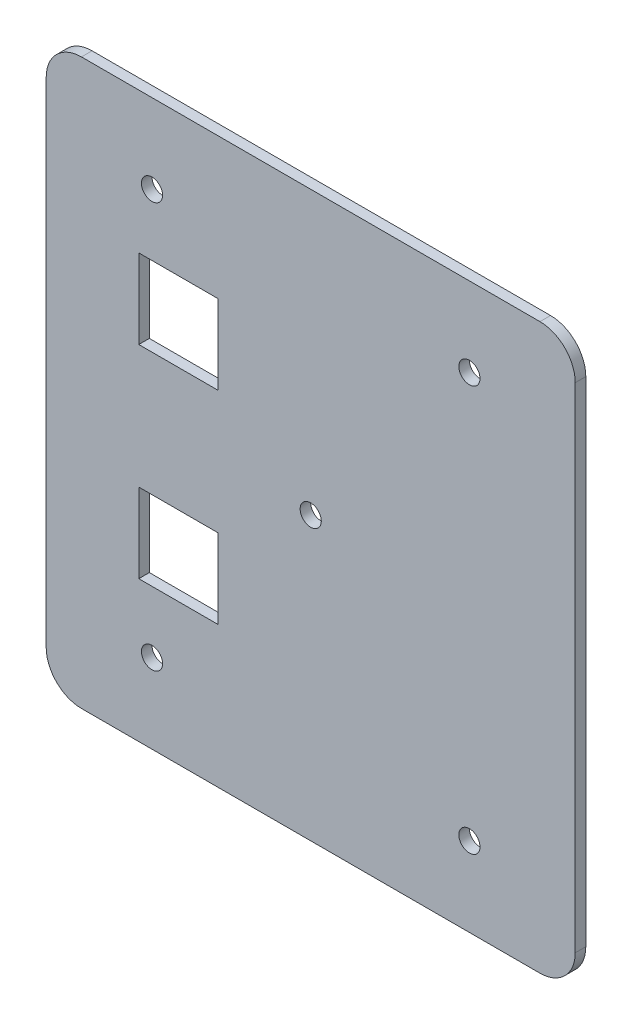
from build123d import *

# Parameters (mm, degrees)
SKETCH1_R           = 6
SKETCH1_W           = 45
SKETCH1_H           = 45
BOSS_EXTRUDE1_DEPTH = 6


with BuildPart() as part:
    # Sketch1 → Boss-Extrude1 (new body)
    with BuildSketch(Plane.XY):
        with BuildLine():
            Line((-55, -102.5), (205, -102.5))
            ThreePointArc((205, -102.5), (219.142135624, -96.642135624), (225, -82.5))
            Line((225, -82.5), (225, 197.5))
            ThreePointArc((225, 197.5), (219.142135624, 211.642135624), (205, 217.5))
            Line((205, 217.5), (-55, 217.5))
            ThreePointArc((-55, 217.5), (-69.142135624, 211.642135624), (-75, 197.5))
            Line((-75, 197.5), (-75, -82.5))
            ThreePointArc((-75, -82.5), (-69.142135624, -96.642135624), (-55, -102.5))
        make_face()
        with Locations((165, 172.5)):
            Circle(SKETCH1_R, mode=Mode.SUBTRACT)
        with Locations((-15, -57.5)):
            Circle(SKETCH1_R, mode=Mode.SUBTRACT)
        Polygon((22.5, -22.5), (-22.5, -22.5), (-22.5, 22.5), (0, 22.5), (22.5, 22.5), align=None, mode=Mode.SUBTRACT)
        with Locations((165, -57.5)):
            Circle(SKETCH1_R, mode=Mode.SUBTRACT)
        with Locations((0, 115)):
            Rectangle(SKETCH1_W, SKETCH1_H, mode=Mode.SUBTRACT)
        with Locations((-15, 172.5)):
            Circle(SKETCH1_R, mode=Mode.SUBTRACT)
        with Locations((75, 57.5)):
            Circle(SKETCH1_R, mode=Mode.SUBTRACT)
    extrude(amount=BOSS_EXTRUDE1_DEPTH)


solid = part.part
